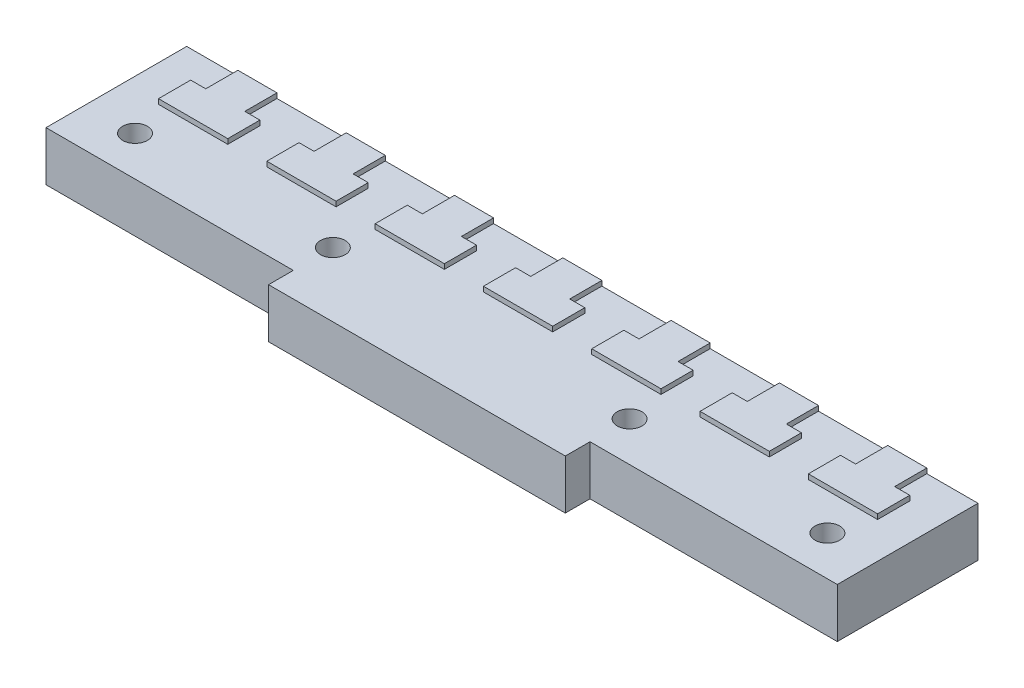
from build123d import *

# Parameters (mm, degrees)
SKETCH2_W           = 160
SKETCH2_H           = 28.45
BOSS_EXTRUDE1_DEPTH = 10
SKETCH4_W           = 60
SKETCH4_H           = 10
BOSS_EXTRUDE2_DEPTH = 5
SKETCH5_R           = 2.5
CUT_EXTRUDE1_DEPTH  = 83.883053907
BOSS_EXTRUDE3_DEPTH = 1


with BuildPart() as part:
    # Sketch2 → Boss-Extrude1 (new body)
    with BuildSketch(Plane(origin=(0, 0, 0), x_dir=(1, 0, 0), z_dir=(0, 1, 0))):
        Rectangle(SKETCH2_W, SKETCH2_H)
    extrude(amount=BOSS_EXTRUDE1_DEPTH)

    # Sketch4 → Boss-Extrude2 (add)
    with BuildSketch(Plane.XY.offset(14.225)):
        with Locations((0, 5)):
            Rectangle(SKETCH4_W, SKETCH4_H)
    extrude(amount=BOSS_EXTRUDE2_DEPTH)

    # Sketch5 → Cut-Extrude1 (cut, through all)
    with BuildSketch(Plane(origin=(0, 10, 0), x_dir=(1, 0, 0), z_dir=(0, 1, 0))):
        with Locations(Location((70, -6.225, 0), (0, 0, 270))):
            Circle(SKETCH5_R)
        with Locations(Location((30, -6.225, 0), (0, 0, 270))):
            Circle(SKETCH5_R)
        with Locations(Location((-30, -6.225, 0), (0, 0, 90))):
            Circle(SKETCH5_R)
        with Locations(Location((-70, -6.225, 0), (0, 0, 90))):
            Circle(SKETCH5_R)
    extrude(amount=-CUT_EXTRUDE1_DEPTH, mode=Mode.SUBTRACT)

    # Sketch6 → Boss-Extrude3 (add)
    with BuildSketch(Plane(origin=(0, 10, 0), x_dir=(1, 0, 0), z_dir=(0, 1, 0))):
        Polygon((3.95, 14.225), (3.95, 7.725), (7, 7.725), (7, 1.225), (0, 1.225), (-7, 1.225), (-7, 7.725), (-3.95, 7.725), (-3.95, 14.225), align=None)
        Polygon((-17.95, 14.225), (-25.85, 14.225), (-25.85, 7.725), (-28.9, 7.725), (-28.9, 1.225), (-21.9, 1.225), (-14.9, 1.225), (-14.9, 7.725), (-17.95, 7.725), align=None)
        Polygon((-39.85, 14.225), (-47.75, 14.225), (-47.75, 7.725), (-50.8, 7.725), (-50.8, 1.225), (-43.8, 1.225), (-36.8, 1.225), (-36.8, 7.725), (-39.85, 7.725), align=None)
        Polygon((-61.75, 14.225), (-69.65, 14.225), (-69.65, 7.725), (-72.7, 7.725), (-72.7, 1.225), (-65.7, 1.225), (-58.7, 1.225), (-58.7, 7.725), (-61.75, 7.725), align=None)
        Polygon((25.85, 14.225), (17.95, 14.225), (17.95, 7.725), (14.9, 7.725), (14.9, 1.225), (21.9, 1.225), (28.9, 1.225), (28.9, 7.725), (25.85, 7.725), align=None)
        Polygon((47.75, 14.225), (39.85, 14.225), (39.85, 7.725), (36.8, 7.725), (36.8, 1.225), (43.8, 1.225), (50.8, 1.225), (50.8, 7.725), (47.75, 7.725), align=None)
        Polygon((69.65, 14.225), (61.75, 14.225), (61.75, 7.725), (58.7, 7.725), (58.7, 1.225), (65.7, 1.225), (72.7, 1.225), (72.7, 7.725), (69.65, 7.725), align=None)
    extrude(amount=BOSS_EXTRUDE3_DEPTH)


solid = part.part
